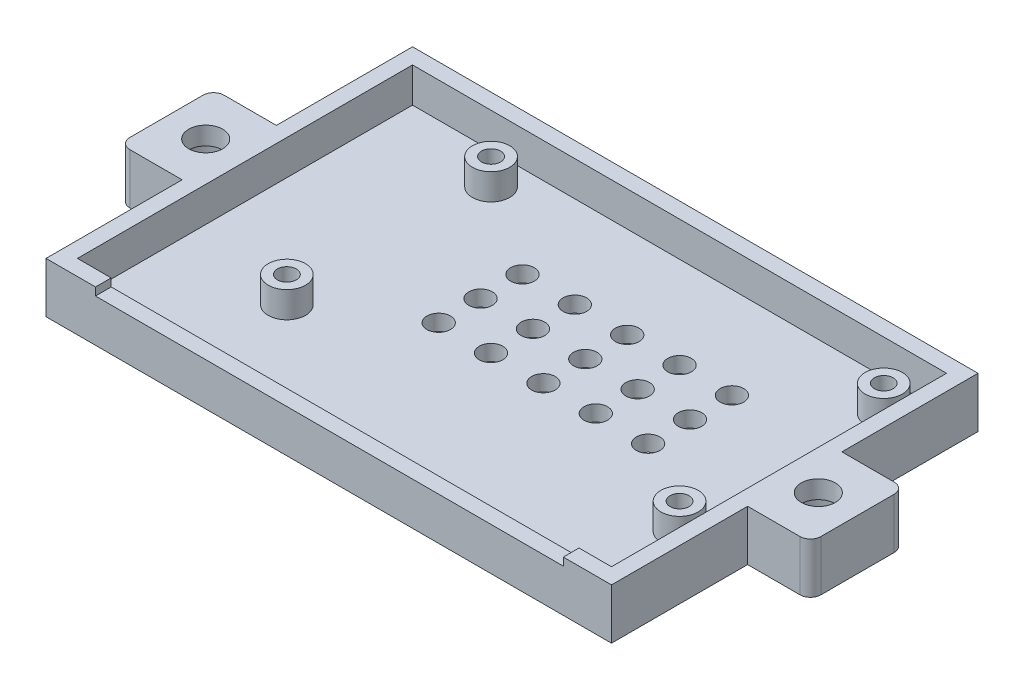
from build123d import *

# Parameters (mm, degrees)
SKETCH2_W           = 108
SKETCH2_H           = 70
SKETCH2_R           = 2.25
BOSS_EXTRUDE1_DEPTH = 3
SKETCH5_R           = 3.5635
SKETCH5_R_2         = 1.8135
BOSS_EXTRUDE2_DEPTH = 5
SKETCH6_R           = 1.8135
BOSS_EXTRUDE3_DEPTH = 2
SKETCH7_W           = 108
SKETCH7_H           = 70
SKETCH7_W_2         = 102
SKETCH7_H_2         = 64
BOSS_EXTRUDE4_DEPTH = 6.65
SKETCH9_W           = 89.35
SKETCH9_H           = 3
CUT_EXTRUDE1_DEPTH  = 1.5
SKETCH11_W          = 12
SKETCH11_H          = 18
SKETCH11_R          = 3.25
BOSS_EXTRUDE5_DEPTH = 9.65
FILLET1_R           = 2
SKETCH12_R          = 5.5
CUT_EXTRUDE2_DEPTH  = 6.2


with BuildPart() as part:
    # Sketch2 → Boss-Extrude1 (new body)
    with BuildSketch(Plane(origin=(0, 0, 0), x_dir=(1, 0, 0), z_dir=(0, 1, 0))):
        with Locations((-7.231065886, 6.378485879)):
            Rectangle(SKETCH2_W, SKETCH2_H)
        with Locations(Location((20.268934114, 4.878485879, 0), (0, 0, 270))):
            Circle(SKETCH2_R, mode=Mode.SUBTRACT)
        with Locations(Location((10.268934114, 4.878485879, 0), (0, 0, 270))):
            Circle(SKETCH2_R, mode=Mode.SUBTRACT)
        with Locations(Location((0.268934114, 4.878485879, 0), (0, 0, 270))):
            Circle(SKETCH2_R, mode=Mode.SUBTRACT)
        with Locations(Location((10.268934114, 12.878485879, 0), (0, 0, 270))):
            Circle(SKETCH2_R, mode=Mode.SUBTRACT)
        with Locations(Location((0.268934114, 12.878485879, 0), (0, 0, 270))):
            Circle(SKETCH2_R, mode=Mode.SUBTRACT)
        with Locations(Location((10.268934114, 20.878485879, 0), (0, 0, 270))):
            Circle(SKETCH2_R, mode=Mode.SUBTRACT)
        with Locations(Location((0.268934114, 20.878485879, 0), (0, 0, 270))):
            Circle(SKETCH2_R, mode=Mode.SUBTRACT)
        with Locations(Location((20.268934114, 12.878485879, 0), (0, 0, 270))):
            Circle(SKETCH2_R, mode=Mode.SUBTRACT)
        with Locations(Location((20.268934114, 20.878485879, 0), (0, 0, 270))):
            Circle(SKETCH2_R, mode=Mode.SUBTRACT)
        with Locations(Location((-9.731065886, 4.878485879, 0), (0, 0, 270))):
            Circle(SKETCH2_R, mode=Mode.SUBTRACT)
        with Locations(Location((-9.731065886, 12.878485879, 0), (0, 0, 270))):
            Circle(SKETCH2_R, mode=Mode.SUBTRACT)
        with Locations(Location((-9.731065886, 20.878485879, 0), (0, 0, 270))):
            Circle(SKETCH2_R, mode=Mode.SUBTRACT)
        with Locations(Location((-19.731065886, 4.878485879, 0), (0, 0, 270))):
            Circle(SKETCH2_R, mode=Mode.SUBTRACT)
        with Locations(Location((-19.731065886, 12.878485879, 0), (0, 0, 270))):
            Circle(SKETCH2_R, mode=Mode.SUBTRACT)
        with Locations(Location((-19.731065886, 20.878485879, 0), (0, 0, 270))):
            Circle(SKETCH2_R, mode=Mode.SUBTRACT)
    extrude(amount=-BOSS_EXTRUDE1_DEPTH)

    # Sketch5 → Boss-Extrude2 (add)
    # profile 1 of 4: a face of its own
    with BuildSketch(Plane(origin=(0, 0, 0), x_dir=(1, 0, 0), z_dir=(0, 1, 0))):
        with Locations(Location((-37.231065886, 32.378485879, 0), (0, 0, 270))):
            Circle(SKETCH5_R)
        with Locations(Location((-37.231065886, 32.378485879, 0), (0, 0, 270))):
            Circle(SKETCH5_R_2, mode=Mode.SUBTRACT)
    # profile 2 of 4: a face of its own
    with BuildSketch(Plane(origin=(0, 0, 0), x_dir=(1, 0, 0), z_dir=(0, 1, 0))):
        with Locations(Location((37.768934114, 32.378485879, 0), (0, 0, 270))):
            Circle(SKETCH5_R)
        with Locations(Location((37.768934114, 32.378485879, 0), (0, 0, 270))):
            Circle(SKETCH5_R_2, mode=Mode.SUBTRACT)
    # profile 3 of 4: a face of its own
    with BuildSketch(Plane(origin=(0, 0, 0), x_dir=(1, 0, 0), z_dir=(0, 1, 0))):
        with Locations(Location((37.768934114, -6.621514121, 0), (0, 0, 270))):
            Circle(SKETCH5_R)
        with Locations(Location((37.768934114, -6.621514121, 0), (0, 0, 270))):
            Circle(SKETCH5_R_2, mode=Mode.SUBTRACT)
    # profile 4 of 4: a face of its own
    with BuildSketch(Plane(origin=(0, 0, 0), x_dir=(1, 0, 0), z_dir=(0, 1, 0))):
        with Locations(Location((-37.231065886, -6.621514121, 0), (0, 0, 270))):
            Circle(SKETCH5_R)
        with Locations(Location((-37.231065886, -6.621514121, 0), (0, 0, 270))):
            Circle(SKETCH5_R_2, mode=Mode.SUBTRACT)
    extrude(amount=BOSS_EXTRUDE2_DEPTH)

    # Sketch6 → Boss-Extrude3 (add)
    with BuildSketch(Plane(origin=(0, 0, 0), x_dir=(1, 0, 0), z_dir=(0, 1, 0))):
        with Locations(Location((-37.231065886, 32.378485879, 0), (0, 0, 270))):
            Circle(SKETCH6_R)
        with Locations(Location((37.768934114, 32.378485879, 0), (0, 0, 270))):
            Circle(SKETCH6_R)
        with Locations(Location((37.768934114, -6.621514121, 0), (0, 0, 270))):
            Circle(SKETCH6_R)
        with Locations(Location((-37.231065886, -6.621514121, 0), (0, 0, 270))):
            Circle(SKETCH6_R)
    extrude(amount=BOSS_EXTRUDE3_DEPTH)

    # Sketch7 → Boss-Extrude4 (add)
    with BuildSketch(Plane(origin=(0, 0, 0), x_dir=(1, 0, 0), z_dir=(0, 1, 0))):
        with Locations((-7.231065886, 6.378485879)):
            Rectangle(SKETCH7_W, SKETCH7_H)
        with Locations((-7.231065886, 6.378485879)):
            Rectangle(SKETCH7_W_2, SKETCH7_H_2, mode=Mode.SUBTRACT)
    extrude(amount=BOSS_EXTRUDE4_DEPTH)

    # Sketch9 → Cut-Extrude1 (cut)
    with BuildSketch(Plane(origin=(0, 6.65, 0), x_dir=(1, 0, 0), z_dir=(0, 1, 0))):
        with Locations((-7.106065886, -27.121514121)):
            Rectangle(SKETCH9_W, SKETCH9_H)
    extrude(amount=-CUT_EXTRUDE1_DEPTH, mode=Mode.SUBTRACT)

    # Sketch11 → Boss-Extrude5 (add)
    # profile 1 of 2: a face of its own
    with BuildSketch(Plane.XZ.offset(3)):
        with Locations((-67.231065886, -6.378485879)):
            Rectangle(SKETCH11_W, SKETCH11_H)
        with Locations(Location((-65.731065886, -6.378485879, 0), (0, 0, 270))):
            Circle(SKETCH11_R, mode=Mode.SUBTRACT)
    # profile 2 of 2: a face of its own
    with BuildSketch(Plane.XZ.offset(3)):
        with Locations((52.768934114, -6.378485879)):
            Rectangle(SKETCH11_W, SKETCH11_H)
        with Locations(Location((51.268934114, -6.378485879, 0), (0, 0, 90))):
            Circle(SKETCH11_R, mode=Mode.SUBTRACT)
    extrude(amount=-BOSS_EXTRUDE5_DEPTH)

    # Fillet1
    fillet1_edges = [part.edges().sort_by_distance(p)[0] for p in [
        (-73.231065886, 1.825, -15.378485879),
        (-73.231065886, 1.825, 2.621514121),
        (58.768934114, 1.825, 2.621514121),
        (58.768934114, 1.825, -15.378485879),
    ]]
    fillet(fillet1_edges, radius=FILLET1_R)

    # Sketch12 → Cut-Extrude2 (cut)
    with BuildSketch(Plane.XZ.offset(3)):
        with Locations(Location((-65.731065886, -6.378485879, 0), (0, 0, 270))):
            Circle(SKETCH12_R)
        with Locations(Location((51.268934114, -6.378485879, 0), (0, 0, 270))):
            Circle(SKETCH12_R)
    extrude(amount=-CUT_EXTRUDE2_DEPTH, mode=Mode.SUBTRACT)


solid = part.part
